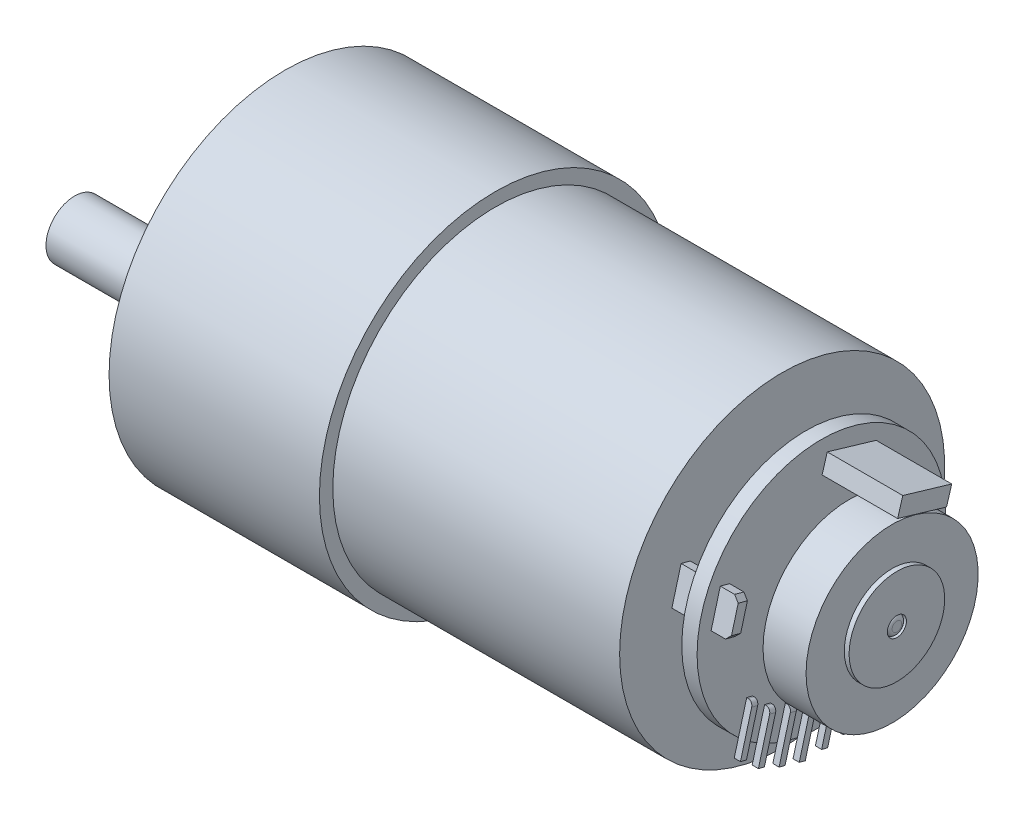
from build123d import *

# Parameters (mm, degrees)
SKETCH2_R           = 6
BOSS_EXTRUDE1_DEPTH = 6.5
SKETCH3_R           = 3
BOSS_EXTRUDE2_DEPTH = 15.5
CUT_EXTRUDE1_START  = -12
CUT_EXTRUDE1_DEPTH  = 12
CHAMFER1_SIZE       = 1
SKETCH5_R           = 1.23
CUT_EXTRUDE2_DEPTH  = 5
CIRPATTERN1_COUNT   = 6
BOSS_EXTRUDE3_DEPTH = 7.9
BOSS_EXTRUDE4_DEPTH = 6.1
CHAMFER2_SIZE       = 0.5
BOSS_EXTRUDE5_DEPTH = 0.65
FILLET1_R           = 0.5
CUT_EXTRUDE3_DEPTH  = 1


with BuildPart() as part:
    # Sketch1 → Revolve1 (revolve)
    with BuildSketch(Plane.XY, mode=Mode.PRIVATE) as revolve1_sk:
        with BuildLine():
            Line((0, 0), (64, 0))
            Line((64, 0), (64, 0.5))
            ThreePointArc((64, 0.5), (63.853553391, 0.853553391), (63.5, 1))
            Line((63.5, 1), (64, 1))
            Line((64, 1), (64, 5))
            Line((64, 5), (63.5, 5))
            Line((63.5, 5), (63.5, 9))
            Line((63.5, 9), (59, 9))
            Line((59, 9), (59, 1))
            Line((59, 1), (56.1, 1))
            Line((56.1, 1), (56.1, 13))
            Line((56.1, 13), (54.5, 13))
            Line((54.5, 13), (54.5, 1))
            Line((54.5, 1), (52, 1))
            Line((52, 1), (52, 17))
            Line((52, 17), (22, 17))
            Line((22, 17), (22, 18.4))
            Line((22, 18.4), (0, 18.4))
            Line((0, 18.4), (0, 0))
        make_face()
    revolve(revolve1_sk.sketch.rotate(Axis((0, 0, 0), (1, 0, 0)), 90), axis=Axis((0, 0, 0), (1, 0, 0)))

    # Sketch2 → Boss-Extrude1 (add)
    with BuildSketch(Plane.ZY):
        with Locations(Location((0, -7, 0), (0, 0, 180))):
            Circle(SKETCH2_R)
    extrude(amount=BOSS_EXTRUDE1_DEPTH)

    # Sketch3 → Boss-Extrude2 (add)
    with BuildSketch(Plane.ZY.offset(6.5)):
        with Locations((0, -7)):
            Circle(SKETCH3_R)
    extrude(amount=BOSS_EXTRUDE2_DEPTH)

    # Sketch4 → Cut-Extrude1 (cut)
    with BuildSketch(Plane.ZY.offset(22).offset(CUT_EXTRUDE1_START)):
        with BuildLine():
            Line((1.5, -9.598076211), (-1.5, -9.598076211))
            ThreePointArc((-1.5, -9.598076211), (0, -10), (1.5, -9.598076211))
        make_face()
    extrude(amount=CUT_EXTRUDE1_DEPTH, mode=Mode.SUBTRACT)

    # Chamfer1
    chamfer1_edges = [part.edges().sort_by_distance(p)[0] for p in [
        (-6.5, -7, 6),
    ]]
    chamfer(chamfer1_edges, length=CHAMFER1_SIZE)

    # Sketch5 → Cut-Extrude2 (cut)
    with BuildSketch(Plane.ZY):
        with Locations((15.5, 0)):
            Circle(SKETCH5_R)
    cut_extrude2 = extrude(amount=-CUT_EXTRUDE2_DEPTH, mode=Mode.SUBTRACT)

    # CirPattern1: Cut-Extrude2 ×6 about axis
    cirpattern1_axis = Axis((0, 0, 0), (1, 0, 0))
    for i in range(1, CIRPATTERN1_COUNT):
        add(cut_extrude2.rotate(cirpattern1_axis, i * 360 / CIRPATTERN1_COUNT), mode=Mode.SUBTRACT)

    # Sketch6 → Boss-Extrude3 (add)
    with BuildSketch(Plane(origin=(56.1, 0, 0), x_dir=(0, 0, -1), z_dir=(1, 0, 0))):
        Polygon((0.614545099, 11.559081954), (5.734377326, 10.04515307), (5.196377764, 8.225736367), (0.076545537, 9.739665251), align=None)
    extrude(amount=BOSS_EXTRUDE3_DEPTH)

    # Sketch7 → Boss-Extrude4 (add)
    with BuildSketch(Plane(origin=(52, 0, 0), x_dir=(0, 0, -1), z_dir=(1, 0, 0))):
        Polygon((-10.569640254, 4.993749072), (-11.532445624, 1.431369202), (-10.567082231, 1.170460177), (-9.604276861, 4.732840047), align=None)
        Polygon((10.960206493, -0.825128427), (9.997401123, -4.387508297), (10.962764516, -4.648417322), (11.925569886, -1.086037452), align=None)
    extrude(amount=BOSS_EXTRUDE4_DEPTH)

    # Chamfer2
    chamfer2_edges = [part.edges().sort_by_distance(p)[0] for p in [
        (58.1, 1.300914689, 11.049763927),
        (58.1, 4.86329456, 10.086958557),
        (58.1, -4.51796281, -10.480082819),
        (58.1, -0.955582939, -11.44288819),
    ]]
    chamfer(chamfer2_edges, length=CHAMFER2_SIZE)

    # Sketch9 → Boss-Extrude5 (add)
    with BuildSketch(Plane(origin=(56.1, 0, 0), x_dir=(0, 0, -1), z_dir=(1, 0, 0))):
        Polygon((-7.807702145, -6.480963086), (-9.112247271, -11.307780051), (-8.484761066, -11.477370917), (-7.18021594, -6.650553952), align=None)
        Polygon((-5.932615753, -8.052596911), (-7.237160879, -12.879413876), (-6.609674674, -13.049004742), (-5.305129548, -8.222187777), align=None)
        Polygon((-3.769488931, -8.99589657), (-5.074034056, -13.822713535), (-4.446547851, -13.992304402), (-3.142002725, -9.165487437), align=None)
        Polygon((-1.65786261, -9.621868256), (-2.962407736, -14.448685221), (-2.33492153, -14.618276088), (-1.030376405, -9.791459122), align=None)
        Polygon((0.680101248, -9.624615249), (-0.624443878, -14.451432214), (0.003042327, -14.62102308), (1.307587453, -9.794206115), align=None)
        Polygon((2.920113487, -9.395250912), (1.615568361, -14.222067877), (2.243054567, -14.391658744), (3.547599693, -9.564841778), align=None)
    extrude(amount=BOSS_EXTRUDE5_DEPTH)

    # Fillet1
    fillet1_edges = [part.edges().sort_by_distance(p)[0] for p in [
        (56.75, -6.565758519, 7.493959043),
        (56.75, -8.137392344, 5.618872651),
        (56.75, -9.080692003, 3.455745828),
        (56.75, -9.706663689, 1.344119507),
        (56.75, -9.709410682, -0.99384435),
        (56.75, -9.480046345, -3.23385659),
    ]]
    fillet(fillet1_edges, radius=FILLET1_R)

    # Sketch14 → Cut-Extrude3 (cut)
    with BuildSketch(Plane.ZY):
        with BuildLine():
            ThreePointArc((-9.613871703, -7.181467181), (0, 12), (9.613871703, -7.181467181))
            ThreePointArc((9.613871703, -7.181467181), (8.626247239, -7.502469221), (7.993556247, -6.678972713))
            ThreePointArc((7.993556247, -6.678972713), (0, 1), (-7.993556247, -6.678972713))
            ThreePointArc((-7.993556247, -6.678972713), (-8.626247239, -7.502469221), (-9.613871703, -7.181467181))
        make_face()
    extrude(amount=-CUT_EXTRUDE3_DEPTH, mode=Mode.SUBTRACT)


solid = part.part
